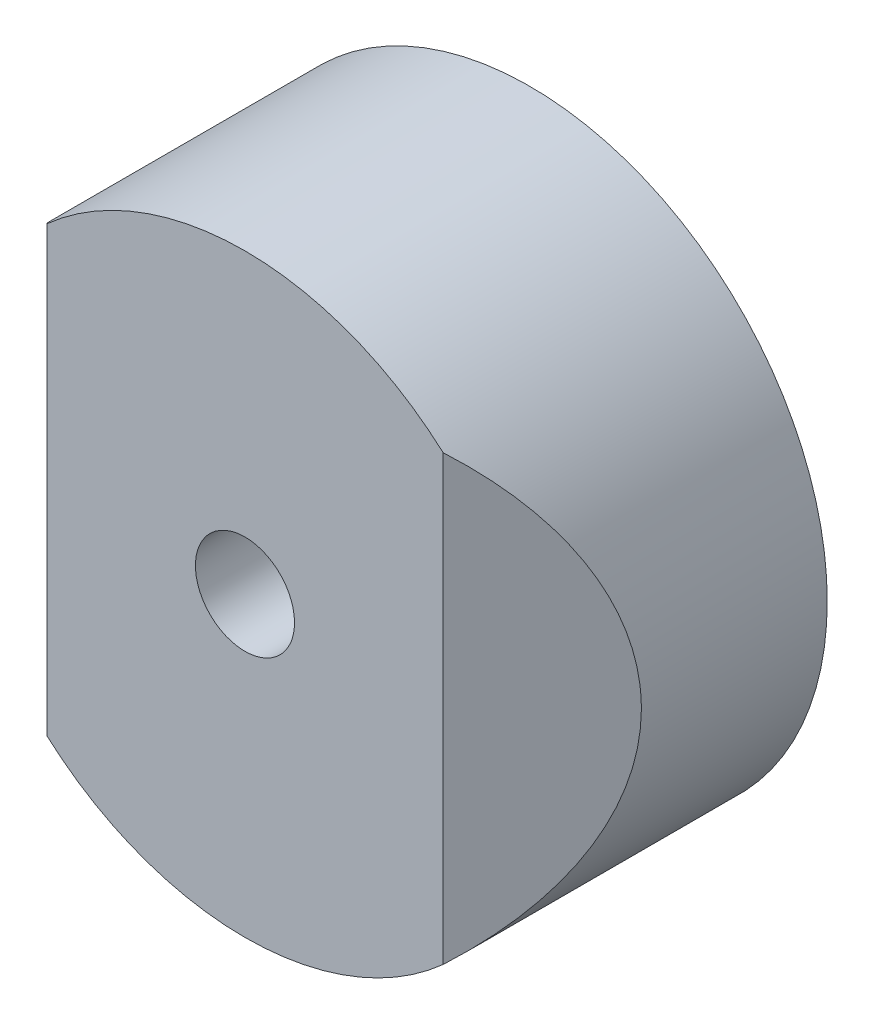
from build123d import *

# Parameters (mm, degrees)
SKETCH1_R               = 38.1
SKETCH1_R_2             = 6.35
BOSS_EXTRUDE1_DEPTH     = 36.5125
CUT_EXTRUDE1_DEPTH      = 66.0875
CUT_EXTRUDE1_DEPTH_BACK = 66.0875


with BuildPart() as part:
    # Sketch1 → Boss-Extrude1 (new body)
    with BuildSketch(Plane.XY):
        Circle(SKETCH1_R)
        Circle(SKETCH1_R_2, mode=Mode.SUBTRACT)
    extrude(amount=-BOSS_EXTRUDE1_DEPTH)

    # Sketch2 → Cut-Extrude1 (cut, two sides: drawn at the far end of the back side and taken through both)
    with BuildSketch(Plane(origin=(0, 0, 0), x_dir=(1, 0, 0), z_dir=(0, 1, 0)).offset(-CUT_EXTRUDE1_DEPTH_BACK)):
        Polygon((-38.1, 12.7), (-25.4, 0), (-38.1, 0), align=None)
        Polygon((38.1, 0), (25.4, 0), (38.1, 12.7), align=None)
    extrude(amount=CUT_EXTRUDE1_DEPTH + CUT_EXTRUDE1_DEPTH_BACK, mode=Mode.SUBTRACT)


solid = part.part
